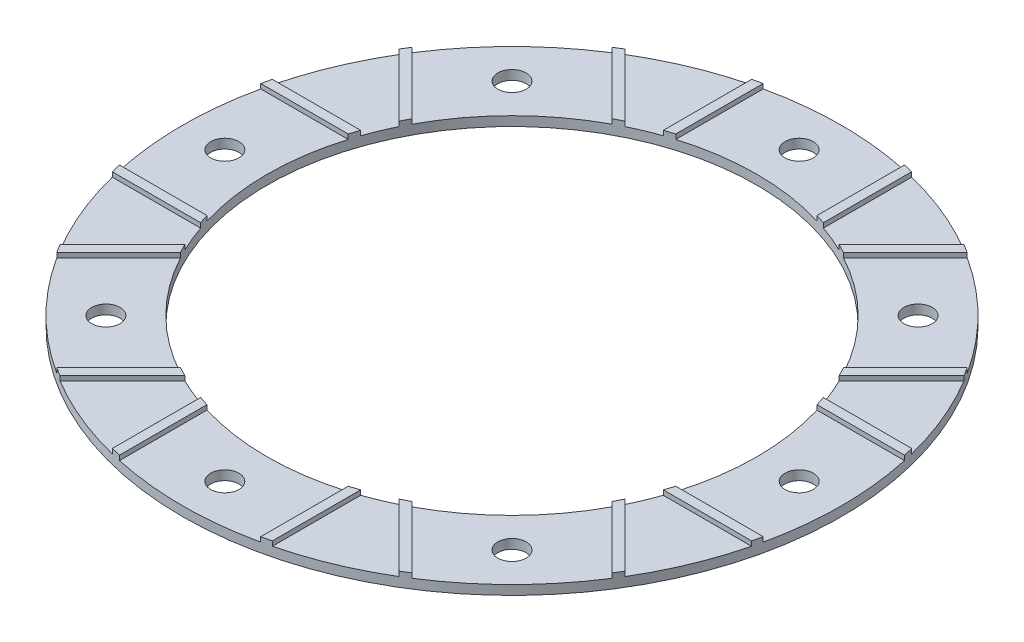
from build123d import *
from build123d.topology import SkipClean

# Parameters (mm, degrees)
SKETCH_1_R               = 35
SKETCH_1_R_2             = 26
SKETCH_1_R_3             = 1.5
EXTRUDE_1_DEPTH          = 1
EXTRUDE_2_DEPTH          = 0.5
PATTERN_CIRCULAR_1_COUNT = 8


with BuildPart() as part:
    # Эскиз1 → Бобышка-Вытянуть1 (new body)
    with BuildSketch(Plane(origin=(0, 0, 0), x_dir=(1, 0, 0), z_dir=(0, 1, 0))):
        with Locations(Location((0, 0, 0), (0, 0, 270))):
            Circle(SKETCH_1_R)
        with Locations(Location((0, 0, 0), (0, 0, 270))):
            Circle(SKETCH_1_R_2, mode=Mode.SUBTRACT)
        with Locations(Location((0, 30.5, 0), (0, 0, 270))):
            Circle(SKETCH_1_R_3, mode=Mode.SUBTRACT)
        with Locations(Location((21.566756826, 21.566756826, 0), (0, 0, 270))):
            Circle(SKETCH_1_R_3, mode=Mode.SUBTRACT)
        with Locations(Location((30.5, 0, 0), (0, 0, 270))):
            Circle(SKETCH_1_R_3, mode=Mode.SUBTRACT)
        with Locations(Location((21.566756826, -21.566756826, 0), (0, 0, 270))):
            Circle(SKETCH_1_R_3, mode=Mode.SUBTRACT)
        with Locations(Location((0, -30.5, 0), (0, 0, 270))):
            Circle(SKETCH_1_R_3, mode=Mode.SUBTRACT)
        with Locations(Location((-21.566756826, -21.566756826, 0), (0, 0, 270))):
            Circle(SKETCH_1_R_3, mode=Mode.SUBTRACT)
        with Locations(Location((-30.5, 0, 0), (0, 0, 270))):
            Circle(SKETCH_1_R_3, mode=Mode.SUBTRACT)
        with Locations(Location((-21.566756826, 21.566756826, 0), (0, 0, 270))):
            Circle(SKETCH_1_R_3, mode=Mode.SUBTRACT)
    extrude(amount=EXTRUDE_1_DEPTH)

    # Эскиз2 → Бобышка-Вытянуть2 (add)
    with SkipClean():  # the faces are left unmerged after this step: merging them gives an invalid solid
        with BuildSketch(Plane(origin=(0, 1, 0), x_dir=(1, 0, 0), z_dir=(0, 1, 0))):
            with BuildLine():
                ThreePointArc((-7.5, 34.186985828), (-8.000861476, 34.0732478), (-8.5, 33.952172243))
                Line((-8.5, 33.952172243), (-8.5, 24.571324751))
                ThreePointArc((-8.5, 24.571324751), (-8.001634558, 24.738105109), (-7.5, 24.894778569))
                Line((-7.5, 24.894778569), (-7.5, 34.186985828))
            make_face()
            with BuildLine():
                ThreePointArc((8.5, 33.952172243), (8.000861476, 34.0732478), (7.5, 34.186985828))
                Line((7.5, 34.186985828), (7.5, 24.894778569))
                ThreePointArc((7.5, 24.894778569), (8.001634558, 24.738105109), (8.5, 24.571324751))
                Line((8.5, 24.571324751), (8.5, 33.952172243))
            make_face()
        extrude_2 = extrude(amount=EXTRUDE_2_DEPTH)

    # Круговой массив1: Бобышка-Вытянуть2 ×8 about axis
    with SkipClean():  # the faces are left unmerged after this step: merging them gives an invalid solid
        pattern_circular_1_axis = Axis((0, 0, 0), (0, 1, 0))
        for i in range(1, PATTERN_CIRCULAR_1_COUNT):
            add(extrude_2.rotate(pattern_circular_1_axis, i * 360 / PATTERN_CIRCULAR_1_COUNT))


solid = part.part
